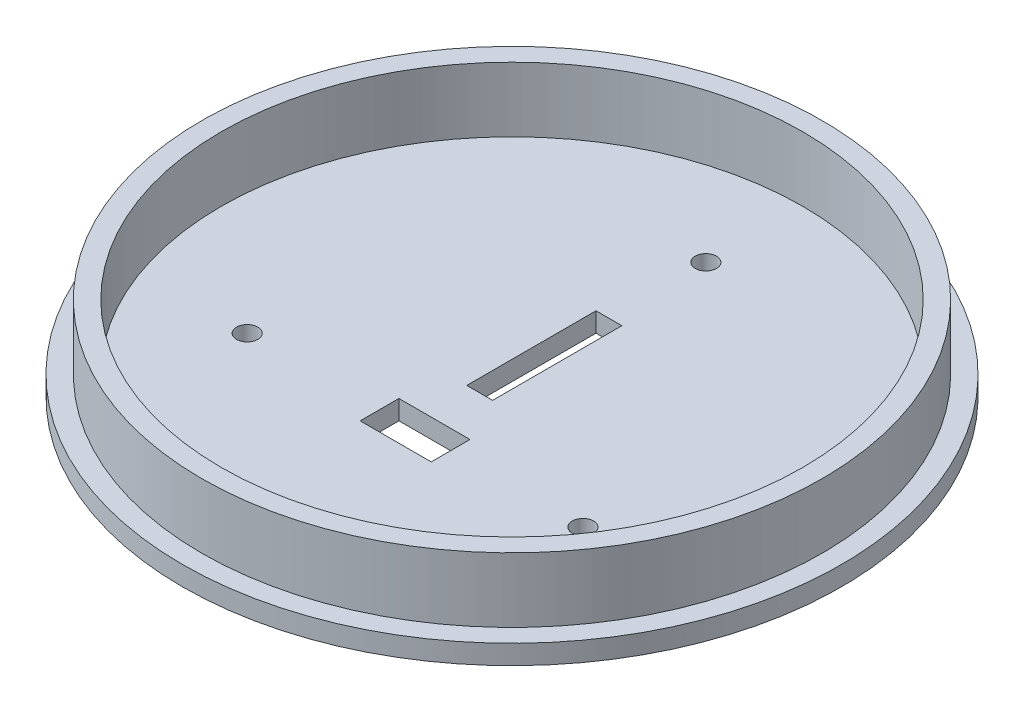
from build123d import *

# Parameters (mm, degrees)
SKETCH_1_R               = 51
EXTRUDE_1_DEPTH          = 3
SKETCH_2_R               = 48
SKETCH_2_R_2             = 45
EXTRUDE_2_DEPTH          = 10
SKETCH_5_R               = 1.65
CUT_EXTRUDE_1_DEPTH      = 10
PATTERN_CIRCULAR_1_COUNT = 3
SKETCH_6_W               = 4
SKETCH_6_H               = 20
SKETCH_6_W_2             = 11
SKETCH_6_H_2             = 6
CUT_EXTRUDE_2_DEPTH      = 10


with BuildPart() as part:
    # Эскиз1 → Бобышка-Вытянуть1 (new body)
    with BuildSketch(Plane(origin=(0, 0, 0), x_dir=(1, 0, 0), z_dir=(0, 1, 0))):
        with Locations(Location((0, 0, 0), (0, 0, 270))):
            Circle(SKETCH_1_R)
    extrude(amount=EXTRUDE_1_DEPTH)

    # Эскиз2 → Бобышка-Вытянуть2 (add)
    with BuildSketch(Plane(origin=(0, 3, 0), x_dir=(1, 0, 0), z_dir=(0, 1, 0))):
        with Locations(Location((0, 0, 0), (0, 0, 270))):
            Circle(SKETCH_2_R)
        with Locations(Location((0, 0, 0), (0, 0, 270))):
            Circle(SKETCH_2_R_2, mode=Mode.SUBTRACT)
    extrude(amount=EXTRUDE_2_DEPTH)

    # Эскиз5 → Вырез-Вытянуть1 (cut)
    with BuildSketch(Plane(origin=(0, 3, 0), x_dir=(1, 0, 0), z_dir=(0, 1, 0))):
        with Locations(Location((0, 30, 0), (0, 0, 270))):
            Circle(SKETCH_5_R)
    cut_extrude_1 = extrude(amount=-CUT_EXTRUDE_1_DEPTH, mode=Mode.SUBTRACT)

    # Круговой массив1: Вырез-Вытянуть1 ×3 about axis
    pattern_circular_1_axis = Axis((0, 0, 0), (0, 1, 0))
    for i in range(1, PATTERN_CIRCULAR_1_COUNT):
        add(cut_extrude_1.rotate(pattern_circular_1_axis, i * 360 / PATTERN_CIRCULAR_1_COUNT), mode=Mode.SUBTRACT)

    # Эскиз6 → Вырез-Вытянуть2 (cut)
    with BuildSketch(Plane(origin=(0, 3, 0), x_dir=(1, 0, 0), z_dir=(0, 1, 0))):
        with Locations((0, 5)):
            Rectangle(SKETCH_6_W, SKETCH_6_H)
        with Locations((0, -15)):
            Rectangle(SKETCH_6_W_2, SKETCH_6_H_2)
    extrude(amount=-CUT_EXTRUDE_2_DEPTH, mode=Mode.SUBTRACT)


solid = part.part
